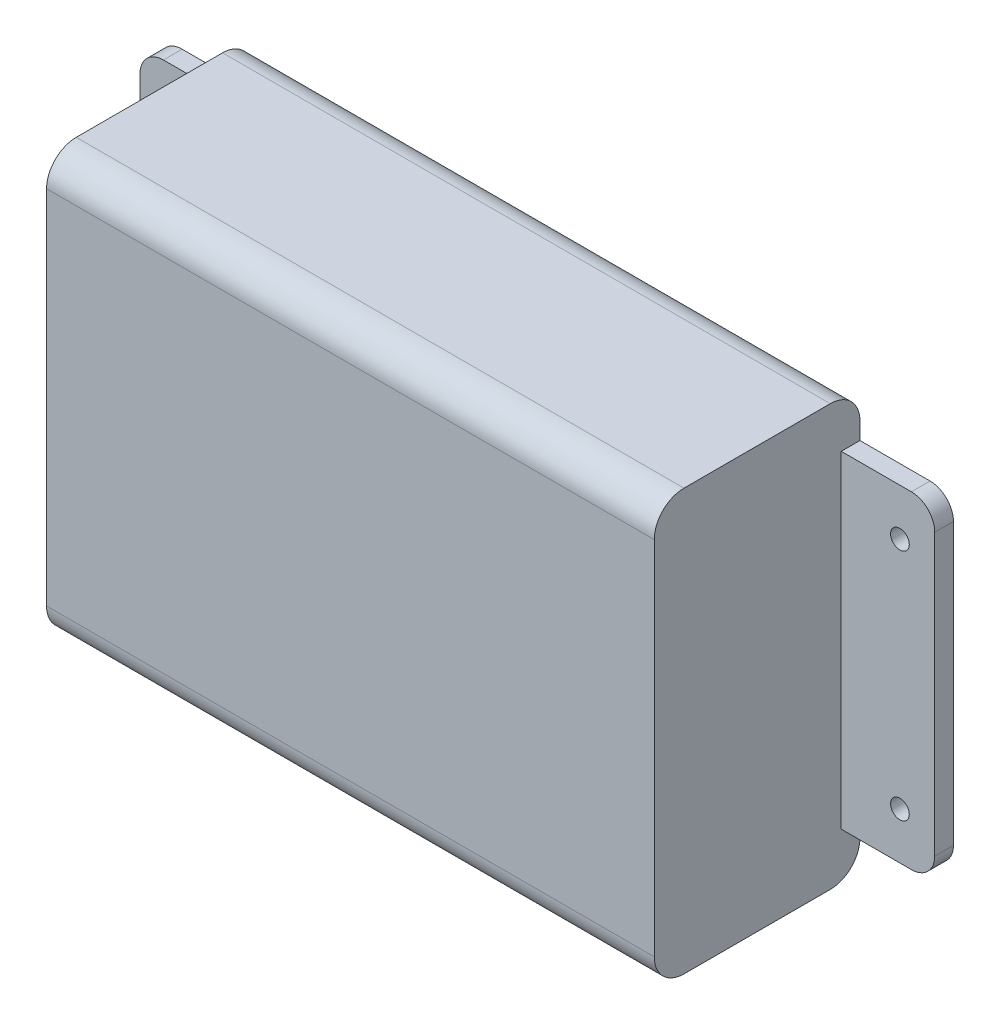
from build123d import *

# Parameters (mm, degrees)
SKETCH1_W           = 170
SKETCH1_H           = 90
BOSS_EXTRUDE1_DEPTH = 44
FILLET1_R           = 6.35
SKETCH3_W           = 20
SKETCH3_H           = 90
CUT_EXTRUDE7_DEPTH  = 40
SKETCH5_W           = 20
SKETCH5_H           = 10
SKETCH5_W_2         = 21.101892403
CUT_EXTRUDE8_DEPTH  = 36
SKETCH6_R           = 2
CUT_EXTRUDE9_DEPTH  = 36
FILLET3_R           = 5
CUT_EXTRUDE10_DEPTH = 10
FILLET4_R           = 6.35


with BuildPart() as part:
    # Sketch1 → Boss-Extrude1 (new body)
    with BuildSketch(Plane.XY):
        with Locations((85, -45)):
            Rectangle(SKETCH1_W, SKETCH1_H)
    extrude(amount=BOSS_EXTRUDE1_DEPTH)

    # Fillet1
    fillet1_edges = [part.edges().sort_by_distance(p)[0] for p in [
        (85, 0, 0),
        (85, -90, 0),
    ]]
    fillet(fillet1_edges, radius=FILLET1_R)

    # Sketch3 → Cut-Extrude7 (cut)
    with BuildSketch(Plane.XY.offset(44)):
        with Locations((160, -45)):
            Rectangle(SKETCH3_W, SKETCH3_H)
        with Locations((10, -45)):
            Rectangle(SKETCH3_W, SKETCH3_H)
    extrude(amount=-CUT_EXTRUDE7_DEPTH, mode=Mode.SUBTRACT)

    # Sketch5 → Cut-Extrude8 (cut)
    with BuildSketch(Plane.XY.offset(4)):
        with Locations((10, -5)):
            Rectangle(SKETCH5_W, SKETCH5_H)
        with Locations((10, -85)):
            Rectangle(SKETCH5_W, SKETCH5_H)
        with Locations((160, -5)):
            Rectangle(SKETCH5_W, SKETCH5_H)
        with Locations((160.550946202, -85)):
            Rectangle(SKETCH5_W_2, SKETCH5_H)
    extrude(amount=-CUT_EXTRUDE8_DEPTH, mode=Mode.SUBTRACT)

    # Sketch6 → Cut-Extrude9 (cut)
    with BuildSketch(Plane(origin=(0, 0, 0), x_dir=(-1, 0, 0), z_dir=(0, 0, -1))):
        with Locations((-162.552288005, -20)):
            Circle(SKETCH6_R)
        with Locations((-162.552288005, -70)):
            Circle(SKETCH6_R)
        with Locations((-10.503526876, -20)):
            Circle(SKETCH6_R)
        with Locations((-10.503526876, -70)):
            Circle(SKETCH6_R)
    extrude(amount=-CUT_EXTRUDE9_DEPTH, mode=Mode.SUBTRACT)

    # Fillet3
    fillet3_edges = [part.edges().sort_by_distance(p)[0] for p in [
        (170, -10, 2),
        (170, -80, 2),
        (0, -10, 2),
        (0, -80, 2),
    ]]
    fillet(fillet3_edges, radius=FILLET3_R)

    # Sketch7 → Cut-Extrude10 (cut)
    with BuildSketch(Plane(origin=(0, 0, 0), x_dir=(-1, 0, 0), z_dir=(0, 0, -1))):
        with BuildLine():
            Line((-96.51448024, -37.104485471), (-94.368564713, -37.104485471))
            add(Edge.make_bspline(
                [(-94.368564713, -37.104485471), (-94.030339848, -37.10373553), (-93.344172793, -37.102214101), (-92.301225612, -37.097402664), (-91.23001935, -37.086812056), (-90.506795242, -37.075683844), (-90.140316341, -37.070044852)],
                knots=[0, 0, 0, 0, 0.95986119, 1.947299551, 2.95983638, 4, 4, 4, 4], degree=3))
            Line((-90.140316341, -37.070044852), (-90.084681494, -37.141575369))
            Line((-90.084681494, -37.141575369), (-90.603940066, -39.986900402))
            Line((-90.603940066, -39.986900402), (-90.961592654, -40.047833806))
            Line((-90.961592654, -40.047833806), (-91.515291845, -37.782700749))
            Line((-91.515291845, -37.782700749), (-95.648166194, -37.782700749))
            Line((-95.648166194, -37.782700749), (-95.648166194, -42.869315332))
            Line((-95.648166194, -42.869315332), (-94.834837716, -42.869315332))
            add(Edge.make_bspline(
                [(-94.834837716, -42.869315332), (-94.674994905, -42.869839396), (-94.347352, -42.870913613), (-93.842260459, -42.862385291), (-93.310588027, -42.862978347), (-92.946779952, -42.856657126), (-92.760452707, -42.853419662)],
                knots=[0, 0, 0, 0, 0.924608237, 1.895245239, 2.922032839, 4, 4, 4, 4], degree=3))
            add(Edge.make_bspline(
                [(-92.760452707, -42.853419662), (-92.724584352, -42.850394303), (-92.65619372, -42.844625813), (-92.565113834, -42.80005388), (-92.493159218, -42.729975367), (-92.468634828, -42.668426383), (-92.455785687, -42.636178831)],
                knots=[0, 0, 0, 0, 1.068716211, 2.037734312, 2.971903963, 4, 4, 4, 4], degree=3))
            Line((-92.455785687, -42.636178831), (-92.143170833, -41.512884777))
            Line((-92.143170833, -41.512884777), (-91.65835288, -41.494339828))
            add(Edge.make_bspline(
                [(-91.65835288, -41.494339828), (-91.663121253, -41.687730244), (-91.671982478, -42.047114055), (-91.67919509, -42.545212804), (-91.685025691, -42.962029091), (-91.686731953, -43.212837188), (-91.687494943, -43.324991222)],
                knots=[0, 0, 0, 0, 1.267879065, 2.356141637, 3.264914697, 4, 4, 4, 4], degree=3))
            add(Edge.make_bspline(
                [(-91.687494943, -43.324991222), (-91.686727762, -43.434495955), (-91.685001556, -43.680888548), (-91.679190202, -44.091523259), (-91.671973438, -44.584323677), (-91.663120269, -44.94017493), (-91.65835288, -45.131799111)],
                knots=[0, 0, 0, 0, 0.727191112, 1.636226109, 2.727119176, 4, 4, 4, 4], degree=3))
            Line((-91.65835288, -45.131799111), (-92.143170833, -45.16623973))
            Line((-92.143170833, -45.16623973), (-92.463733523, -43.831003402))
            add(Edge.make_bspline(
                [(-92.463733523, -43.831003402), (-92.476865639, -43.793047736), (-92.501185263, -43.722756889), (-92.562894944, -43.63601172), (-92.646022045, -43.57964521), (-92.709294889, -43.5706909), (-92.741907758, -43.566075559)],
                knots=[0, 0, 0, 0, 1.165841965, 2.159045699, 3.051112636, 4, 4, 4, 4], degree=3))
            add(Edge.make_bspline(
                [(-92.741907758, -43.566075559), (-92.93088674, -43.563161963), (-93.300004869, -43.55747106), (-93.839597881, -43.553574535), (-94.350886246, -43.546152679), (-94.682060223, -43.547080379), (-94.842785552, -43.54753061)],
                knots=[0, 0, 0, 0, 1.079495133, 2.108494915, 3.082014899, 4, 4, 4, 4], degree=3))
            Line((-94.842785552, -43.54753061), (-95.648166194, -43.54753061))
            Line((-95.648166194, -43.54753061), (-95.648166194, -47.041928858))
            add(Edge.make_bspline(
                [(-95.648166194, -47.041928858), (-95.647080502, -47.394288912), (-95.644922649, -48.094617126), (-95.634700344, -48.794873959), (-95.629621245, -49.142806652)],
                knots=[0, 0, 0, 0, 1.006271195, 2, 2, 2, 2], degree=3))
            Line((-95.629621245, -49.142806652), (-91.33779019, -49.142806652))
            Line((-91.33779019, -49.142806652), (-90.246287478, -46.663082042))
            Line((-90.246287478, -46.663082042), (-89.843597157, -46.591551525))
            Line((-89.843597157, -46.591551525), (-90.042293039, -49.783932032))
            Line((-90.042293039, -49.783932032), (-90.103226443, -49.847514714))
            add(Edge.make_bspline(
                [(-90.103226443, -49.847514714), (-90.482074908, -49.844228456), (-91.223877511, -49.837793813), (-92.314461347, -49.824171655), (-93.360076045, -49.824249289), (-94.042704523, -49.822081827), (-94.376512548, -49.82102193)],
                knots=[0, 0, 0, 0, 1.063875567, 2.083116964, 3.062636615, 4, 4, 4, 4], degree=3))
            Line((-94.376512548, -49.82102193), (-96.477390342, -49.82102193))
            add(Edge.make_bspline(
                [(-96.477390342, -49.82102193), (-96.835926023, -49.82102193), (-97.566243777, -49.82102193), (-98.29656153, -49.82102193), (-98.668343603, -49.82102193)],
                knots=[0, 0, 0, 0, 0.981862152, 2, 2, 2, 2], degree=3))
            Line((-98.668343603, -49.82102193), (-98.702784223, -49.481914291))
            Line((-98.702784223, -49.481914291), (-97.603333675, -49.142806652))
            add(Edge.make_bspline(
                [(-97.603333675, -49.142806652), (-97.569706673, -49.130533807), (-97.505852756, -49.107229046), (-97.427828145, -49.044009578), (-97.375770808, -48.958845077), (-97.366910422, -48.893637097), (-97.362249338, -48.85933386)],
                knots=[0, 0, 0, 0, 1.072356029, 2.036284212, 2.966969876, 4, 4, 4, 4], degree=3))
            add(Edge.make_bspline(
                [(-97.362249338, -48.85933386), (-97.359319931, -48.730406727), (-97.353140527, -48.458442751), (-97.349274787, -48.027457832), (-97.342081351, -47.55060978), (-97.34314648, -47.216784552), (-97.343704389, -47.041928858)],
                knots=[0, 0, 0, 0, 0.851424291, 1.796027954, 2.845572385, 4, 4, 4, 4], degree=3))
            Line((-97.343704389, -47.041928858), (-97.343704389, -39.629247814))
            add(Edge.make_bspline(
                [(-97.343704389, -39.629247814), (-97.343136256, -39.481767252), (-97.342057781, -39.201807345), (-97.349277496, -38.802676167), (-97.353119016, -38.444097059), (-97.359318709, -38.218060158), (-97.362249338, -38.111211274)],
                knots=[0, 0, 0, 0, 1.165661162, 2.212755269, 3.155159611, 4, 4, 4, 4], degree=3))
            add(Edge.make_bspline(
                [(-97.362249338, -38.111211274), (-97.365106246, -38.074388142), (-97.370491709, -38.004974083), (-97.416412492, -37.913110899), (-97.484184734, -37.839219739), (-97.545419942, -37.814123206), (-97.57684089, -37.801245698)],
                knots=[0, 0, 0, 0, 1.089053236, 2.052937975, 3.000925474, 4, 4, 4, 4], degree=3))
            Line((-97.57684089, -37.801245698), (-98.684239274, -37.44359311))
            Line((-98.684239274, -37.44359311), (-98.702784223, -37.104485471))
            add(Edge.make_bspline(
                [(-98.702784223, -37.104485471), (-98.328352871, -37.104485471), (-97.598918211, -37.104485471), (-96.86948355, -37.104485471), (-96.51448024, -37.104485471)],
                knots=[0, 0, 0, 0, 1.026634383, 2, 2, 2, 2], degree=3))
        make_face()
        with BuildLine():
            add(Edge.make_bspline(
                [(-81.673222482, -37.917813949), (-81.82539073, -37.871337241), (-82.121915734, -37.780769688), (-82.564150573, -37.687327752), (-82.987193257, -37.623876658), (-83.263459898, -37.61665923), (-83.397902739, -37.61314693)],
                knots=[0, 0, 0, 0, 1.085488502, 2.115253907, 3.082804142, 4, 4, 4, 4], degree=3))
            add(Edge.make_bspline(
                [(-83.397902739, -37.61314693), (-83.494235526, -37.614319536), (-83.681991773, -37.616604991), (-83.955339608, -37.644560759), (-84.214294032, -37.68555595), (-84.457590102, -37.747140801), (-84.687204272, -37.822702242), (-84.899913874, -37.919867566), (-85.100161087, -38.029911773), (-85.28182092, -38.160392668), (-85.448110053, -38.302938581), (-85.59080048, -38.461901179), (-85.712094122, -38.634743988), (-85.812535602, -38.819223331), (-85.891365947, -39.018274297), (-85.941644787, -39.231748858), (-85.978903163, -39.457522926), (-85.982009267, -39.61318628), (-85.983598486, -39.692830496)],
                knots=[0, 0, 0, 0, 1.234208642, 2.405519354, 3.51827187, 4.591643104, 5.618907388, 6.611863802, 7.584813727, 8.542701907, 9.473318954, 10.386986489, 11.272527839, 12.174055887, 13.073663442, 14.007029733, 14.980308792, 16, 16, 16, 16], degree=3))
            add(Edge.make_bspline(
                [(-85.983598486, -39.692830496), (-85.980548707, -39.78927318), (-85.974637569, -39.976200232), (-85.928710005, -40.247806018), (-85.852451406, -40.501218802), (-85.742762696, -40.735790419), (-85.604097309, -40.951370978), (-85.449229634, -41.156204974), (-85.268796623, -41.345001783), (-85.001534798, -41.583783838), (-84.618541614, -41.849281459), (-84.114419888, -42.128522171), (-83.574307084, -42.38533369), (-83.205605717, -42.553660648), (-83.019055924, -42.638828109)],
                knots=[0, 0, 0, 0, 0.778259039, 1.508436541, 2.216563713, 2.908683688, 3.591078706, 4.282647702, 4.978612309, 5.695584281, 7.173255772, 8.727829764, 10.344398109, 12, 12, 12, 12], degree=3))
            add(Edge.make_bspline(
                [(-83.019055924, -42.638828109), (-82.813476111, -42.730947543), (-82.405685634, -42.91367671), (-81.812539566, -43.211063628), (-81.249487206, -43.534904246), (-80.826893149, -43.858684767), (-80.522134928, -44.144621331), (-80.320092976, -44.382129984), (-80.141891547, -44.640520259), (-79.987573223, -44.919238101), (-79.860452008, -45.220048834), (-79.774803823, -45.546558024), (-79.720452278, -45.895621732), (-79.71361949, -46.136546739), (-79.710107166, -46.260391721)],
                knots=[0, 0, 0, 0, 1.543398054, 3.0615021, 4.545469272, 5.98688264, 6.697343335, 7.405507011, 8.118847824, 8.844680014, 9.585218838, 10.349959468, 11.151813912, 12, 12, 12, 12], degree=3))
            add(Edge.make_bspline(
                [(-79.710107166, -46.260391721), (-79.713436567, -46.407299844), (-79.719934285, -46.694008292), (-79.792148934, -47.109728808), (-79.901920177, -47.500079234), (-80.059389183, -47.863866018), (-80.263079961, -48.19944511), (-80.507809751, -48.511127778), (-80.804062696, -48.788915622), (-81.13719187, -49.042525611), (-81.50540607, -49.266645638), (-81.90177636, -49.459568341), (-82.321813306, -49.623897759), (-82.765286979, -49.759630727), (-83.233352565, -49.861840252), (-83.725400848, -49.935642068), (-84.242163232, -49.981318168), (-84.595281666, -49.98744723), (-84.775527522, -49.990575749)],
                knots=[0, 0, 0, 0, 0.995693307, 1.943212381, 2.853401529, 3.741575323, 4.623157416, 5.510178669, 6.421254701, 7.370287868, 8.346430534, 9.34050028, 10.357381684, 11.403528079, 12.483557003, 13.604551818, 14.777266867, 16, 16, 16, 16], degree=3))
            add(Edge.make_bspline(
                [(-84.775527522, -49.990575749), (-85.019545759, -49.984009303), (-85.520699893, -49.970523421), (-86.290512924, -49.870746151), (-87.098107183, -49.719622303), (-87.642919287, -49.573100173), (-87.922870296, -49.497809961)],
                knots=[0, 0, 0, 0, 0.916293707, 1.881844505, 2.911588482, 4, 4, 4, 4], degree=3))
            Line((-87.922870296, -49.497809961), (-87.975855864, -49.426279444))
            Line((-87.975855864, -49.426279444), (-87.538724923, -46.323974404))
            Line((-87.538724923, -46.323974404), (-87.136034602, -46.260391721))
            Line((-87.136034602, -46.260391721), (-86.510804893, -48.771907672))
            add(Edge.make_bspline(
                [(-86.510804893, -48.771907672), (-86.352780765, -48.828785174), (-86.039070667, -48.941698606), (-85.553542595, -49.057332665), (-85.062885097, -49.128316282), (-84.733374097, -49.137981715), (-84.568883805, -49.142806652)],
                knots=[0, 0, 0, 0, 1.013176663, 2.01136215, 3.007281639, 4, 4, 4, 4], degree=3))
            add(Edge.make_bspline(
                [(-84.568883805, -49.142806652), (-84.461062466, -49.141852984), (-84.25029369, -49.139988757), (-83.944335025, -49.108923886), (-83.65544326, -49.065291653), (-83.386409696, -49.001530443), (-83.133716688, -48.922836741), (-82.901753459, -48.822114584), (-82.686972202, -48.704376129), (-82.490269192, -48.570203386), (-82.315828188, -48.416431448), (-82.162723009, -48.247716456), (-82.032026718, -48.064136899), (-81.924590533, -47.864354038), (-81.846480096, -47.64761917), (-81.788148325, -47.417882575), (-81.748964313, -47.173073479), (-81.746181148, -47.004112896), (-81.744753, -46.917412772)],
                knots=[0, 0, 0, 0, 1.270299755, 2.483177503, 3.621207158, 4.711934724, 5.739017396, 6.736776301, 7.687149045, 8.622641224, 9.537225582, 10.421574316, 11.302485812, 12.187263261, 13.086374941, 14.010388254, 14.979054274, 16, 16, 16, 16], degree=3))
            add(Edge.make_bspline(
                [(-81.744753, -46.917412772), (-81.747884638, -46.822750073), (-81.753980375, -46.638489033), (-81.799055627, -46.371043057), (-81.876833852, -46.122002266), (-81.983737385, -45.890166335), (-82.116321616, -45.675483299), (-82.272688223, -45.47900176), (-82.444486182, -45.29315618), (-82.712211087, -45.071257787), (-83.084306122, -44.812359929), (-83.580430412, -44.544192781), (-84.109921261, -44.287839962), (-84.472367369, -44.120117538), (-84.656309993, -44.034997841)],
                knots=[0, 0, 0, 0, 0.779269004, 1.516847907, 2.225209504, 2.92148785, 3.61365338, 4.297325759, 4.98662073, 5.693300865, 7.155751331, 8.71165789, 10.331155278, 12, 12, 12, 12], degree=3))
            add(Edge.make_bspline(
                [(-84.656309993, -44.034997841), (-84.864516317, -43.942023486), (-85.27899323, -43.756939176), (-85.883093808, -43.455014915), (-86.448949258, -43.109041382), (-86.884024879, -42.78003304), (-87.189985951, -42.477446561), (-87.399728877, -42.23093255), (-87.578094403, -41.955830852), (-87.73693869, -41.660475806), (-87.865329861, -41.338673924), (-87.954488211, -40.988795863), (-88.007597981, -40.613761556), (-88.014633405, -40.355327078), (-88.018244319, -40.222686182)],
                knots=[0, 0, 0, 0, 1.505590493, 2.997183208, 4.45523457, 5.880494019, 6.585539522, 7.293280273, 8.012930273, 8.745897636, 9.504910951, 10.294054083, 11.12442722, 12, 12, 12, 12], degree=3))
            add(Edge.make_bspline(
                [(-88.018244319, -40.222686182), (-88.014619495, -40.089030732), (-88.007514705, -39.827061131), (-87.938659832, -39.446464907), (-87.831554228, -39.087442678), (-87.675012102, -38.7548659), (-87.481117457, -38.442247362), (-87.236584439, -38.15852966), (-86.950160011, -37.897507018), (-86.624984006, -37.661035421), (-86.26895273, -37.451498159), (-85.890366787, -37.267925994), (-85.492866336, -37.111477851), (-85.076380992, -36.984635795), (-84.641435416, -36.88674816), (-84.187570547, -36.81520583), (-83.714004657, -36.772224019), (-83.391810447, -36.767682115), (-83.22834892, -36.765377832)],
                knots=[0, 0, 0, 0, 0.969870177, 1.900981247, 2.799786438, 3.683637421, 4.562727952, 5.463658981, 6.394306014, 7.371865646, 8.378371075, 9.390988941, 10.424835136, 11.477842863, 12.549919072, 13.660298415, 14.812979307, 16, 16, 16, 16], degree=3))
            add(Edge.make_bspline(
                [(-83.22834892, -36.765377832), (-82.989762407, -36.769464578), (-82.506474511, -36.777742811), (-81.774569186, -36.846058678), (-81.024763135, -36.945963359), (-80.523785898, -37.049302064), (-80.269104915, -37.101836193)],
                knots=[0, 0, 0, 0, 0.959381208, 1.943350944, 2.954464664, 4, 4, 4, 4], degree=3))
            Line((-80.269104915, -37.101836193), (-80.205522233, -37.168068154))
            Line((-80.205522233, -37.168068154), (-80.735377918, -40.013393186))
            Line((-80.735377918, -40.013393186), (-81.093030506, -40.076975868))
            Line((-81.093030506, -40.076975868), (-81.673222482, -37.917813949))
        make_face()
        with BuildLine():
            Line((-68.940790353, -40.135259994), (-69.298442941, -40.190894841))
            Line((-69.298442941, -40.190894841), (-69.952814713, -37.886022608))
            add(Edge.make_bspline(
                [(-69.952814713, -37.886022608), (-70.13252824, -37.844063966), (-70.482237642, -37.762415512), (-70.999267165, -37.680147016), (-71.489822837, -37.621688495), (-71.808917726, -37.61593585), (-71.96361704, -37.61314693)],
                knots=[0, 0, 0, 0, 1.088477901, 2.118098511, 3.087641701, 4, 4, 4, 4], degree=3))
            add(Edge.make_bspline(
                [(-71.96361704, -37.61314693), (-72.141420904, -37.617160047), (-72.488943281, -37.625003791), (-72.994482959, -37.70278725), (-73.472504871, -37.819591254), (-73.921198489, -37.990106831), (-74.338628209, -38.212266654), (-74.729784716, -38.478397061), (-75.088698045, -38.796607591), (-75.415141355, -39.15981351), (-75.710596336, -39.558626993), (-75.959816651, -39.994274121), (-76.180845707, -40.452790995), (-76.353305147, -40.944108458), (-76.493579591, -41.461643522), (-76.584358255, -42.009414978), (-76.650048642, -42.584255408), (-76.655398233, -42.977732805), (-76.658138416, -43.179280909)],
                knots=[0, 0, 0, 0, 1.039745367, 2.032209956, 2.986008345, 3.915042519, 4.832768629, 5.747259039, 6.67724131, 7.632145001, 8.600613798, 9.575568441, 10.564920306, 11.575093636, 12.61800617, 13.698682609, 14.821212704, 16, 16, 16, 16], degree=3))
            add(Edge.make_bspline(
                [(-76.658138416, -43.179280909), (-76.65477236, -43.394085981), (-76.648188012, -43.81426656), (-76.576253467, -44.426995373), (-76.467444168, -45.007167391), (-76.310284284, -45.553477463), (-76.109705322, -46.06712506), (-75.860902136, -46.546155963), (-75.57240595, -46.995205281), (-75.235412764, -47.403917794), (-74.86185584, -47.774924723), (-74.449512642, -48.095815688), (-74.003334203, -48.36967934), (-73.520920223, -48.588373765), (-73.006101617, -48.761567895), (-72.456835362, -48.885734562), (-71.872986523, -48.960863542), (-71.471962498, -48.969060472), (-71.266856814, -48.973252832)],
                knots=[0, 0, 0, 0, 1.150941887, 2.251359443, 3.302310505, 4.312135758, 5.294047232, 6.253145676, 7.201151829, 8.149736938, 9.087009725, 10.0178529, 10.944195404, 11.886808548, 12.85085921, 13.851085601, 14.900927299, 16, 16, 16, 16], degree=3))
            add(Edge.make_bspline(
                [(-71.266856814, -48.973252832), (-71.026339214, -48.966988502), (-70.537310676, -48.954251653), (-69.79526766, -48.852571638), (-69.033749539, -48.696476088), (-68.528200204, -48.542879294), (-68.270522911, -48.464591374)],
                knots=[0, 0, 0, 0, 0.945703394, 1.922836208, 2.941274556, 4, 4, 4, 4], degree=3))
            Line((-68.270522911, -48.464591374), (-68.172499609, -48.843438189))
            add(Edge.make_bspline(
                [(-68.172499609, -48.843438189), (-68.320462144, -48.934873439), (-68.614964189, -49.116864562), (-69.078800727, -49.349496618), (-69.556230173, -49.549597677), (-70.049850636, -49.711077107), (-70.557588735, -49.835101245), (-71.078738989, -49.925974297), (-71.614558732, -49.979381289), (-71.976746008, -49.98681929), (-72.159663644, -49.990575749)],
                knots=[0, 0, 0, 0, 0.991626125, 1.973715307, 2.955869065, 3.941786668, 4.932491397, 5.934424837, 6.956810052, 8, 8, 8, 8], degree=3))
            add(Edge.make_bspline(
                [(-72.159663644, -49.990575749), (-72.394794612, -49.984706355), (-72.855921998, -49.973195586), (-73.531107131, -49.890918431), (-74.172561452, -49.750867949), (-74.779792068, -49.553253347), (-75.356456553, -49.304496227), (-75.898632427, -48.995405199), (-76.407406311, -48.630480891), (-76.877200684, -48.212477034), (-77.303728551, -47.750258378), (-77.676560266, -47.247892709), (-77.990302182, -46.708811921), (-78.249768962, -46.135937866), (-78.447267035, -45.52584781), (-78.590479192, -44.882051112), (-78.676315283, -44.202452211), (-78.687210227, -43.7376458), (-78.69278425, -43.499843598)],
                knots=[0, 0, 0, 0, 1.089467417, 2.136610357, 3.146408505, 4.127352908, 5.091352325, 6.051696722, 7.013591848, 7.987580447, 8.960691772, 9.92320475, 10.880545116, 11.845777148, 12.831880732, 13.846559358, 14.898266216, 16, 16, 16, 16], degree=3))
            add(Edge.make_bspline(
                [(-78.69278425, -43.499843598), (-78.686775607, -43.246986214), (-78.675052038, -42.753631634), (-78.580873614, -42.033986574), (-78.425709639, -41.354548831), (-78.205156709, -40.716000051), (-77.923271336, -40.117157418), (-77.576090076, -39.560791139), (-77.168305582, -39.042824806), (-76.698883956, -38.570594916), (-76.181777849, -38.14619472), (-75.625154346, -37.774487612), (-75.03026433, -37.46529339), (-74.402695023, -37.205639421), (-73.737586156, -37.007507797), (-73.036853233, -36.868455703), (-72.301361977, -36.781821936), (-71.798721773, -36.770931708), (-71.54238177, -36.765377832)],
                knots=[0, 0, 0, 0, 1.096505755, 2.139412049, 3.142010988, 4.114771106, 5.064040669, 6.006865809, 6.953294689, 7.917578308, 8.889191356, 9.850671021, 10.815319772, 11.792714759, 12.792521805, 13.820213443, 14.888337048, 16, 16, 16, 16], degree=3))
            add(Edge.make_bspline(
                [(-71.54238177, -36.765377832), (-71.288783062, -36.770240603), (-70.778033383, -36.780034258), (-70.008389123, -36.851620345), (-69.229868256, -36.967114569), (-68.712394773, -37.079457489), (-68.450673844, -37.136276812)],
                knots=[0, 0, 0, 0, 0.975186661, 1.964033165, 2.970275485, 4, 4, 4, 4], degree=3))
            Line((-68.450673844, -37.136276812), (-68.387091162, -37.210456608))
            Line((-68.387091162, -37.210456608), (-68.940790353, -40.135259994))
        make_face()
    extrude(amount=-CUT_EXTRUDE10_DEPTH, mode=Mode.SUBTRACT)

    # Fillet4
    fillet4_edges = [part.edges().sort_by_distance(p)[0] for p in [
        (85, -90, 44),
        (85, 0, 44),
    ]]
    fillet(fillet4_edges, radius=FILLET4_R)


solid = part.part
